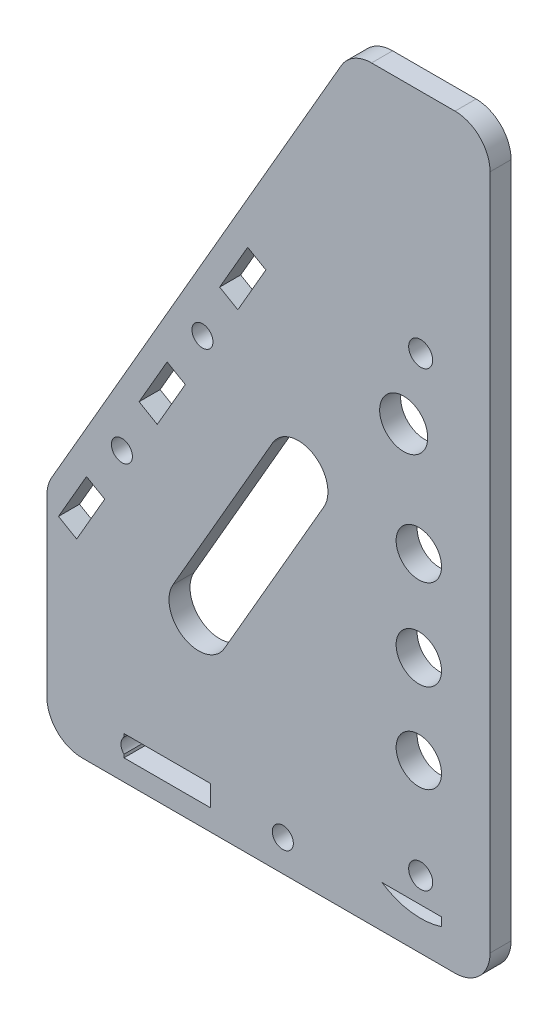
from build123d import *

# Parameters (mm, degrees)
SKETCH1_R            = 1.5
BOSS_EXTRUDE1_DEPTH  = 3
SKETCH3_R            = 1.7144
SKETCH3_R_2          = 3.2384
SKETCH3_R_3          = 3.4289
SKETCH3_R_4          = 1.714400001
CUT_EXTRUDE4_DEPTH   = 106.238487343
SKETCH4_R            = 1.5
CUT_EXTRUDE5_DEPTH   = 106.238487343
CABLEHOLE_DEPTH      = 106.238487343
CABLEHOLE_DEPTH_BACK = 106.238487343
FILLET1_R            = 5


with BuildPart() as part:
    # Sketch1 → Boss-Extrude1 (new body)
    with BuildSketch(Plane.XY):
        Polygon((9.894788559, 90.661246725), (-9.906811441, 90.661246725), (-53.35426469, 15.408050237), (-53.35426469, -15.894788559), (9.894788559, -15.894788559), align=None)
        with BuildLine():
            Line((2.984475762, -9.894788559), (2.984475762, -11.107284946))
            ThreePointArc((2.984475762, -11.107284946), (-1.404084484, -11.470508377), (-5.516079054, -9.894788559))
            Line((-5.516079054, -9.894788559), (2.984475762, -9.894788559))
        make_face(mode=Mode.SUBTRACT)
        with BuildLine():
            Line((-42.353698644, -10.344103475), (-42.353698644, -9.894788559))
            Line((-42.353698644, -9.894788559), (-29.988741988, -9.894788559))
            Line((-29.988741988, -9.894788559), (-29.988741988, -12.894788559))
            Line((-29.988741988, -12.894788559), (-42.353698644, -12.894788559))
            Line((-42.353698644, -12.894788559), (-42.353698644, -12.445473643))
            ThreePointArc((-42.353698644, -12.445473643), (-42.783156326, -11.394788559), (-42.353698644, -10.344103475))
        make_face(mode=Mode.SUBTRACT)
        with Locations((-19.684611441, -11.394788559)):
            Circle(SKETCH1_R, mode=Mode.SUBTRACT)
    extrude(amount=BOSS_EXTRUDE1_DEPTH)

    # Sketch3 → Cut-Extrude4 (cut, through all)
    with BuildSketch(Plane.XY):
        with Locations((-0.011311441, -6.275188559)):
            Circle(SKETCH3_R)
        with Locations((-0.277311441, 7.815511441)):
            Circle(SKETCH3_R_2)
        with Locations((-0.277311441, 20.515511441)):
            Circle(SKETCH3_R_2)
        with Locations((-0.277311441, 33.380511441)):
            Circle(SKETCH3_R_2)
        with Locations((-2.436311441, 48.341911441)):
            Circle(SKETCH3_R_3)
        with Locations((-0.011311441, 58.266061441)):
            Circle(SKETCH3_R_4)
    extrude(amount=CUT_EXTRUDE4_DEPTH, mode=Mode.SUBTRACT)

    # Sketch4 → Cut-Extrude5 (cut, through all)
    with BuildSketch(Plane.XY):
        with Locations((-42.651822313, 24.9452242)):
            Circle(SKETCH4_R)
        with Locations((-31.151822313, 44.863808487)):
            Circle(SKETCH4_R)
        Polygon((-40.200860419, 32.190414728), (-36.200860419, 39.118617958), (-33.602784207, 37.618617958), (-37.602784207, 30.690414728), align=None)
        Polygon((-24.700860419, 59.037202245), (-28.700860419, 52.108999015), (-26.102784207, 50.608999015), (-22.102784207, 57.537202245), align=None)
        Polygon((-51.700860419, 12.271830441), (-47.700860419, 19.200033671), (-45.102784207, 17.700033671), (-49.102784207, 10.771830441), align=None)
    extrude(amount=CUT_EXTRUDE5_DEPTH, mode=Mode.SUBTRACT)

    # Sketch5 → CableHole (cut, two sides: drawn at the far end of the back side and taken through both)
    with BuildSketch(Plane.XY.offset(3).offset(-CABLEHOLE_DEPTH_BACK)):
        with BuildLine():
            Line((-35.366569483, 11.996089665), (-21.139931787, 36.637348974))
            ThreePointArc((-21.139931787, 36.637348974), (-15.361765759, 38.185603895), (-13.813510838, 32.407437867))
            Line((-13.813510838, 32.407437867), (-28.040148533, 7.766178558))
            ThreePointArc((-28.040148533, 7.766178558), (-33.818314562, 6.217923637), (-35.366569483, 11.996089665))
        make_face()
    extrude(amount=CABLEHOLE_DEPTH + CABLEHOLE_DEPTH_BACK, mode=Mode.SUBTRACT)

    # Fillet1
    fillet1_edges = [part.edges().sort_by_distance(p)[0] for p in [
        (-53.35426469, -15.894788559, 1.5),
        (-53.35426469, 15.408050237, 1.5),
        (-9.906811441, 90.661246725, 1.5),
        (9.894788559, 90.661246725, 1.5),
        (9.894788559, -15.894788559, 1.5),
    ]]
    fillet(fillet1_edges, radius=FILLET1_R)


solid = part.part
